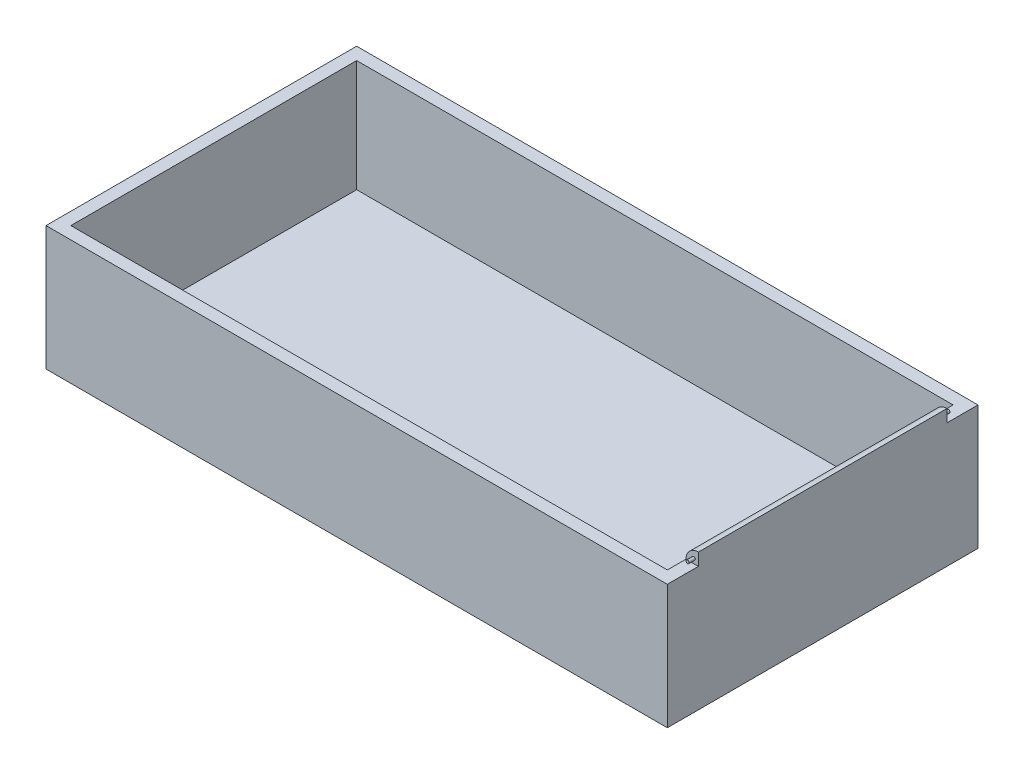
from build123d import *

# Parameters (mm, degrees)
SKETCH1_W                = 127
SKETCH1_H                = 63.5
BOSS_EXTRUDE1_DEPTH      = 25.4
SHELL1_T                 = -2.54
BOSS_EXTRUDE2_DEPTH      = 25.4
BOSS_EXTRUDE2_DEPTH_BACK = 25.4
BOSS_EXTRUDE3_DEPTH      = 1.27
BOSS_EXTRUDE3_DEPTH_BACK = 52.07
SKETCH3_R                = 0.3175


with BuildPart() as part:
    # Sketch1 → Boss-Extrude1 (new body)
    with BuildSketch(Plane(origin=(0, 0, 0), x_dir=(1, 0, 0), z_dir=(0, 1, 0))):
        with Locations((63.5, 31.75)):
            Rectangle(SKETCH1_W, SKETCH1_H)
    extrude(amount=BOSS_EXTRUDE1_DEPTH)

    # Shell1
    shell1_openings = [part.faces().sort_by_distance(p)[0] for p in [
        (63.5, 25.4, -31.75),
    ]]
    offset(amount=SHELL1_T, openings=shell1_openings, kind=Kind.INTERSECTION)

    # Sketch2 → Boss-Extrude2 (add, two sides: drawn at the far end of the back side and taken through both)
    with BuildSketch(Plane.XY.offset(-31.75).offset(-BOSS_EXTRUDE2_DEPTH_BACK)):
        with BuildLine():
            Line((124.46, 25.4), (127, 25.4))
            Line((127, 25.4), (127, 27.94))
            ThreePointArc((127, 27.94), (125.203948776, 27.196051224), (124.46, 25.4))
        make_face()
    extrude(amount=BOSS_EXTRUDE2_DEPTH + BOSS_EXTRUDE2_DEPTH_BACK)

    # Sketch3 → Boss-Extrude3 (add, two sides: drawn at the far end of the back side and taken through both)
    with BuildSketch(Plane.XY.offset(-6.35).offset(-BOSS_EXTRUDE3_DEPTH_BACK)):
        with Locations((126.0475, 26.3525)):
            Circle(SKETCH3_R)
    extrude(amount=BOSS_EXTRUDE3_DEPTH + BOSS_EXTRUDE3_DEPTH_BACK)


solid = part.part
